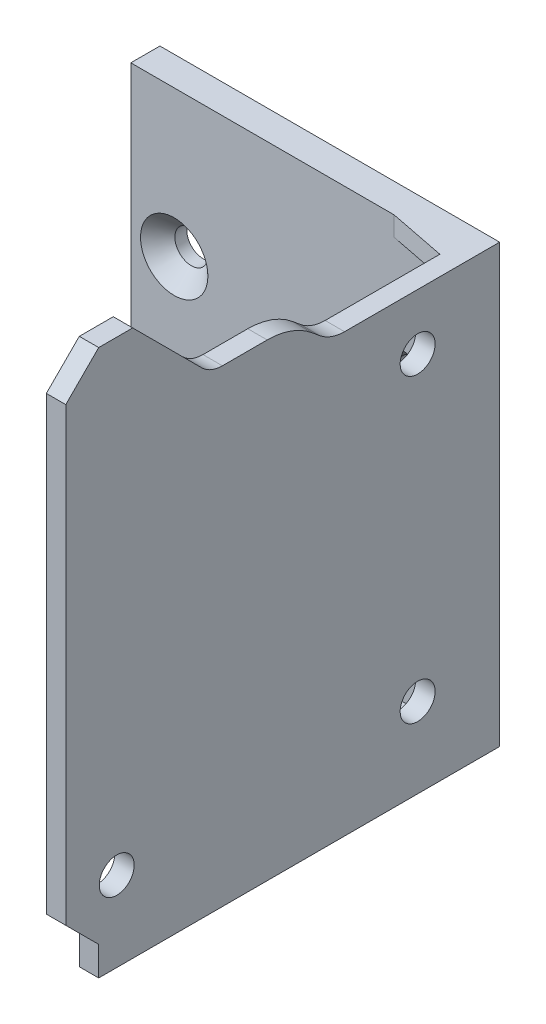
from build123d import *

# Parameters (mm, degrees)
SKETCH1_R                                    = 1.8
BOSS_EXTRUDE1_DEPTH                          = 2
BOSS_EXTRUDE2_DEPTH                          = 33
BOSS_EXTRUDE3_DEPTH                          = 1
BOSS_EXTRUDE4_DEPTH                          = 3
BOSS_EXTRUDE4_DEPTH_BACK                     = 0.0001
BOSS_EXTRUDE5_DEPTH                          = 2.5
CUT_EXTRUDE1_DEPTH                           = 3
CUT_EXTRUDE2_DEPTH                           = 3
CSK_FOR_M3_HEX_SOCKET_COUNTERSUNK_HE_2_COUNT = 2
CSK_FOR_M3_HEX_SOCKET_COUNTERSUNK_HE_2_PITCH = 23
CSK_FOR_M3_HEX_SOCKET_COUNTERSUNK_HE_3_COUNT = 2
CSK_FOR_M3_HEX_SOCKET_COUNTERSUNK_HE_3_PITCH = 22
CSK_FOR_M3_HEX_SOCKET_COUNTERSUNK_HE_4_COUNT = 2
CSK_FOR_M3_HEX_SOCKET_COUNTERSUNK_HE_4_PITCH = 31.827660926
BOSS_EXTRUDE6_DEPTH                          = 2
BOSS_EXTRUDE7_DEPTH                          = 2


with BuildPart() as part:
    # Sketch1 → Boss-Extrude1 (new body)
    with BuildSketch(Plane(origin=(-17.698305603, 0, 0), x_dir=(0, 0, -1), z_dir=(1, 0, 0))):
        with BuildLine():
            Line((-911.775195292, 293.900701951), (-904.075195292, 293.900701951))
            Line((-904.075195292, 293.900701951), (-904.075195292, 251.900701951))
            Line((-904.075195292, 251.900701951), (-910.669307841, 251.900701951))
            Line((-910.669307841, 251.900701951), (-945.381082742, 251.900701951))
            Line((-945.381082742, 251.900701951), (-948.775195292, 255.294814501))
            Line((-948.775195292, 255.294814501), (-948.775195292, 301.756589401))
            Line((-948.775195292, 301.756589401), (-945.381082742, 305.150701951))
            Line((-945.381082742, 305.150701951), (-941.881082742, 305.150701951))
            Line((-941.881082742, 305.150701951), (-938.486970192, 301.756589401))
            Line((-938.486970192, 301.756589401), (-934.759762398, 298.029381608))
            ThreePointArc((-934.759762398, 298.029381608), (-933.786492352, 297.379063354), (-932.638442055, 297.150701951))
            Line((-932.638442055, 297.150701951), (-928.025195292, 297.150701951))
            ThreePointArc((-928.025195292, 297.150701951), (-925.55612657, 296.717313987), (-923.382248102, 295.468963923))
            Line((-923.382248102, 295.468963923), (-922.614211968, 294.828557415))
            ThreePointArc((-922.614211968, 294.828557415), (-921.414830744, 294.139812552), (-920.052585932, 293.900701951))
            Line((-920.052585932, 293.900701951), (-911.775195292, 293.900701951))
        make_face()
        with Locations(Location((-912.525195292, 288.150701951, 0), (0, 0, 90))):
            Circle(SKETCH1_R, mode=Mode.SUBTRACT)
        with Locations(Location((-912.525195292, 257.150701951, 0), (0, 0, 90))):
            Circle(SKETCH1_R, mode=Mode.SUBTRACT)
        with Locations(Location((-943.525195292, 257.150701951, 0), (0, 0, 90))):
            Circle(SKETCH1_R, mode=Mode.SUBTRACT)
    extrude(amount=BOSS_EXTRUDE1_DEPTH)

    # Sketch2 → Boss-Extrude2 (add)
    with BuildSketch(Plane.ZY.offset(17.698305603)):
        Polygon((907.075195292, 293.900701951), (907.075195292, 255.737509851), (907.075195292, 251.900701951), (904.075195292, 251.900701951), (904.075195292, 293.900701951), align=None)
    extrude(amount=BOSS_EXTRUDE2_DEPTH)

    # Sketch3 → Boss-Extrude3 (add)
    with BuildSketch(Plane(origin=(0, 293.900701951, 0), x_dir=(1, 0, 0), z_dir=(0, 1, 0))):
        Polygon((24.09465277, -907.075195292), (-17.698305603, -910.725195292), (-17.698305603, -907.075195292), align=None)
    extrude(amount=-BOSS_EXTRUDE3_DEPTH)

    # Sketch4 → Boss-Extrude4 (add, two sides: drawn at the far end of the back side and taken through both)
    with BuildSketch(Plane.XZ.offset(-251.900701951).offset(-BOSS_EXTRUDE4_DEPTH_BACK)):
        Polygon((-50.698305603, 907.075195292), (-17.698305603, 907.075195292), (-17.698305603, 945.381082742), (-15.698305603, 945.381082742), (-15.698305603, 904.075195292), (-50.698305603, 904.075195292), align=None)
    extrude(amount=BOSS_EXTRUDE4_DEPTH + BOSS_EXTRUDE4_DEPTH_BACK)

    # Sketch5 → Boss-Extrude5 (add)
    with BuildSketch(Plane.XZ.offset(-248.900701951)):
        Polygon((11.795887964, 907.075195292), (-17.698305603, 926.228139017), (-17.698305603, 907.075195292), align=None)
    extrude(amount=-BOSS_EXTRUDE5_DEPTH)

    # Sketch10 → Cut-Extrude1 (cut)
    with BuildSketch(Plane(origin=(0, 293.900701951, 0), x_dir=(1, 0, 0), z_dir=(0, 1, 0))):
        Polygon((-15.698305603, -907.075195292), (-15.698305603, -910.550524718), (24.09465277, -907.075195292), align=None)
    extrude(amount=-CUT_EXTRUDE1_DEPTH, mode=Mode.SUBTRACT)

    # Sketch11 → Cut-Extrude2 (cut)
    with BuildSketch(Plane(origin=(0, 251.400701951, 0), x_dir=(1, 0, 0), z_dir=(0, 1, 0))):
        Polygon((11.795887964, -907.075195292), (-15.698305603, -907.075195292), (-15.698305603, -924.929378725), align=None)
    extrude(amount=-CUT_EXTRUDE2_DEPTH, mode=Mode.SUBTRACT)

    # Sketch15 → CSK for M3 Hex Socket Countersunk Head Screw2 (revolve, cut)
    with BuildSketch(Plane(origin=(-46.228014557, 278.845328546, 907.075195292), x_dir=(0, -1, 0), z_dir=(1, 0, 0))):
        Polygon((0, 0), (0, 3), (1.7, 3), (1.7, 1.77), (3.47, 0), align=None)
    csk_for_m3_hex_socket_countersunk_head_s = revolve(axis=Axis((-46.228014557, 278.845328546, 913.425195292), (0, 0, -1)), mode=Mode.SUBTRACT)

    # CSK for M3 Hex Socket Countersunk He 2: CSK for M3 Hex Socket Countersunk Head Screw2 ×2
    with Locations(*[(i * CSK_FOR_M3_HEX_SOCKET_COUNTERSUNK_HE_2_PITCH, 0, 0) for i in range(1, CSK_FOR_M3_HEX_SOCKET_COUNTERSUNK_HE_2_COUNT)]):
        add(csk_for_m3_hex_socket_countersunk_head_s, mode=Mode.SUBTRACT)

    # CSK for M3 Hex Socket Countersunk He 3: CSK for M3 Hex Socket Countersunk Head Screw2 ×2
    with Locations(*[(0, -i * CSK_FOR_M3_HEX_SOCKET_COUNTERSUNK_HE_3_PITCH, 0) for i in range(1, CSK_FOR_M3_HEX_SOCKET_COUNTERSUNK_HE_3_COUNT)]):
        add(csk_for_m3_hex_socket_countersunk_head_s, mode=Mode.SUBTRACT)

    # CSK for M3 Hex Socket Countersunk He 4: CSK for M3 Hex Socket Countersunk Head Screw2 ×2
    with Locations(*[Vector(0.7226418571476992, -0.6912226459673644, 0) * (i * CSK_FOR_M3_HEX_SOCKET_COUNTERSUNK_HE_4_PITCH) for i in range(1, CSK_FOR_M3_HEX_SOCKET_COUNTERSUNK_HE_4_COUNT)]):
        add(csk_for_m3_hex_socket_countersunk_head_s, mode=Mode.SUBTRACT)

    # Sketch17 → Boss-Extrude7 (add)
    with BuildSketch(Plane(origin=(0, 293.900701951, 0), x_dir=(1, 0, 0), z_dir=(0, 1, 0))):
        Polygon((-17.698305603, -908.234078598), (-23.577151031, -907.075195292), (-17.698305603, -907.075195292), align=None)
    extrude(amount=-BOSS_EXTRUDE7_DEPTH)


with BuildPart() as body_2:
    # Sketch16 → Boss-Extrude6 (new body)
    with BuildSketch(Plane.XZ.offset(-248.900701951)):
        Polygon((-34.198305603, 907.075195292), (-17.698305603, 926.228139017), (-17.698305603, 907.075195292), align=None)
    extrude(amount=-BOSS_EXTRUDE6_DEPTH)


solid = Compound([part.part, body_2.part])
